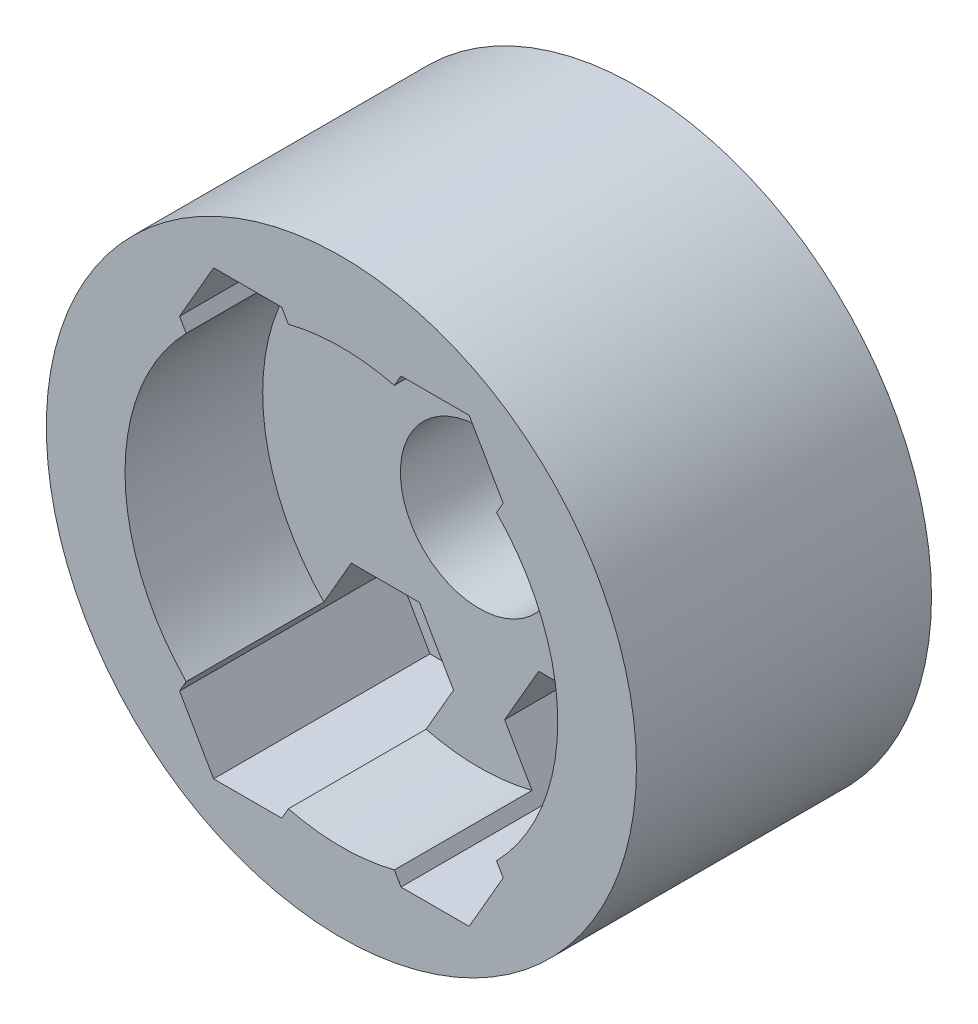
from build123d import *

# Parameters (mm, degrees)
SKETCH1_R           = 15
SKETCH1_R_2         = 1.5
SKETCH1_R_3         = 4
BOSS_EXTRUDE1_DEPTH = 4
BOSS_EXTRUDE2_START = 4
SKETCH1_3_R         = 15
BOSS_EXTRUDE2_DEPTH = 11
SKETCH1_5_R         = 4
BOSS_EXTRUDE3_DEPTH = 8


with BuildPart() as part:
    # Sketch1 → Boss-Extrude1 (new body)
    with BuildSketch(Plane.XY):
        Circle(SKETCH1_R)
        with Locations((4.7625, 8.25)):
            Circle(SKETCH1_R_2, mode=Mode.SUBTRACT)
        with Locations((-4.7625, 8.25)):
            Circle(SKETCH1_R_2, mode=Mode.SUBTRACT)
        Circle(SKETCH1_R_3, mode=Mode.SUBTRACT)
        with Locations((-4.7625, -8.25)):
            Circle(SKETCH1_R_2, mode=Mode.SUBTRACT)
        with BuildLine():
            ThreePointArc((5.755984906, -9.373827274), (5.499445958, -9.526599297), (5.238855076, -9.672352221))
            ThreePointArc((5.238855076, -9.672352221), (4.012575551, -6.950918278), (5.755984906, -9.373827274))
        make_face(mode=Mode.SUBTRACT)
    extrude(amount=BOSS_EXTRUDE1_DEPTH)

    # Sketch1<3> → Boss-Extrude2 (add)
    with BuildSketch(Plane.XY.offset(BOSS_EXTRUDE2_START)):
        Circle(SKETCH1_3_R)
        with BuildLine():
            ThreePointArc((-7.889177559, -7.665564391), (-11, 0), (-7.889177559, 7.665564391))
            Line((-7.889177559, 7.665564391), (-8.226601615, 8.25))
            Line((-8.226601615, 8.25), (-6.494550808, 11.25))
            Line((-6.494550808, 11.25), (-3.030449192, 11.25))
            Line((-3.030449192, 11.25), (-2.692868088, 10.665292376))
            ThreePointArc((-2.692868088, 10.665292376), (0, 11), (2.692868088, 10.665292376))
            Line((2.692868088, 10.665292376), (3.030449192, 11.25))
            Line((3.030449192, 11.25), (6.494550808, 11.25))
            Line((6.494550808, 11.25), (8.226601615, 8.25))
            Line((8.226601615, 8.25), (7.889177559, 7.665564391))
            ThreePointArc((7.889177559, 7.665564391), (10.192667785, 4.136365968), (11, 0))
            ThreePointArc((11, 0), (10.192667785, -4.136365968), (7.889177559, -7.665564391))
            Line((7.889177559, -7.665564391), (8.226601615, -8.25))
            Line((8.226601615, -8.25), (6.494550808, -11.25))
            Line((6.494550808, -11.25), (3.030449192, -11.25))
            Line((3.030449192, -11.25), (2.692868088, -10.665292376))
            ThreePointArc((2.692868088, -10.665292376), (0, -11), (-2.692868088, -10.665292376))
            Line((-2.692868088, -10.665292376), (-3.030449192, -11.25))
            Line((-3.030449192, -11.25), (-6.494550808, -11.25))
            Line((-6.494550808, -11.25), (-8.226601615, -8.25))
            Line((-8.226601615, -8.25), (-7.889177559, -7.665564391))
        make_face(mode=Mode.SUBTRACT)
    extrude(amount=BOSS_EXTRUDE2_DEPTH)

    # Sketch1<5> → Boss-Extrude3 (add)
    with BuildSketch(Plane.XY):
        with BuildLine():
            Line((-3.030449192, 5.25), (-6.494550808, 5.25))
            Line((-6.494550808, 5.25), (-7.889177559, 7.665564391))
            ThreePointArc((-7.889177559, 7.665564391), (-11, 0), (-7.889177559, -7.665564391))
            Line((-7.889177559, -7.665564391), (-6.494550808, -5.25))
            Line((-6.494550808, -5.25), (-3.030449192, -5.25))
            Line((-3.030449192, -5.25), (-1.298398385, -8.25))
            Line((-1.298398385, -8.25), (-2.692868088, -10.665292376))
            ThreePointArc((-2.692868088, -10.665292376), (0, -11), (2.692868088, -10.665292376))
            Line((2.692868088, -10.665292376), (1.298398385, -8.25))
            Line((1.298398385, -8.25), (3.030449192, -5.25))
            Line((3.030449192, -5.25), (6.494550808, -5.25))
            Line((6.494550808, -5.25), (7.889177559, -7.665564391))
            ThreePointArc((7.889177559, -7.665564391), (10.192667785, -4.136365968), (11, 0))
            ThreePointArc((11, 0), (10.192667785, 4.136365968), (7.889177559, 7.665564391))
            Line((7.889177559, 7.665564391), (6.494550808, 5.25))
            Line((6.494550808, 5.25), (3.030449192, 5.25))
            Line((3.030449192, 5.25), (1.298398385, 8.25))
            Line((1.298398385, 8.25), (2.692868088, 10.665292376))
            ThreePointArc((2.692868088, 10.665292376), (0, 11), (-2.692868088, 10.665292376))
            Line((-2.692868088, 10.665292376), (-1.298398385, 8.25))
            Line((-1.298398385, 8.25), (-3.030449192, 5.25))
        make_face()
        Circle(SKETCH1_5_R, mode=Mode.SUBTRACT)
    extrude(amount=BOSS_EXTRUDE3_DEPTH)


solid = part.part
